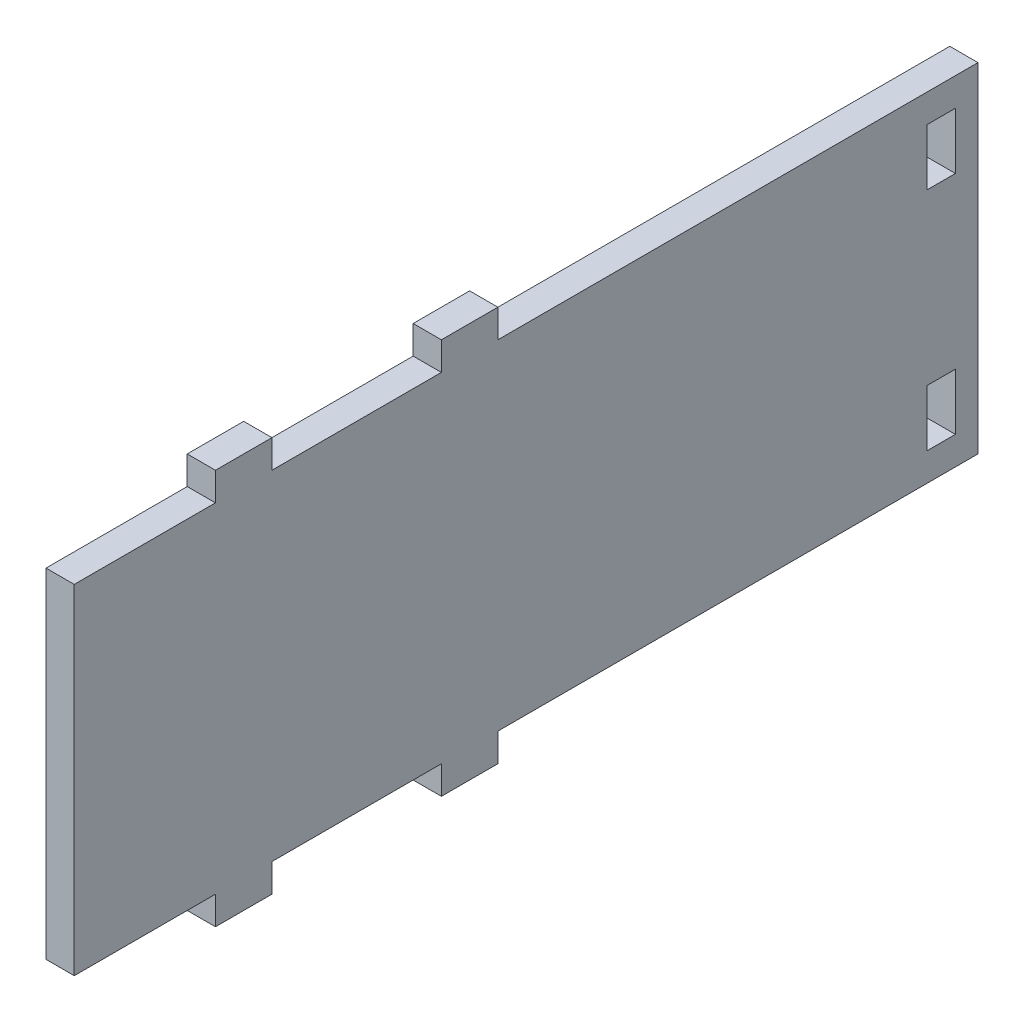
from build123d import *

# Parameters (mm, degrees)
SKETCH1_3_W         = 2.5
SKETCH1_3_H         = 5
BOSS_EXTRUDE2_DEPTH = 2.5


with BuildPart() as part:
    # Sketch1<3> → Boss-Extrude2 (new body)
    with BuildSketch(Plane(origin=(0, 0, 0), x_dir=(0, 0, -1), z_dir=(1, 0, 0))):
        Polygon((-57.5, 17.5), (-57.5, 15), (-72.5, 15), (-72.5, 17.5), (-77.5, 17.5), (-77.5, 15), (-90, 15), (-90, -15), (-77.5, -15), (-77.5, -17.5), (-72.5, -17.5), (-72.5, -15), (-57.5, -15), (-57.5, -17.5), (-52.5, -17.5), (-52.5, -15), (-10, -15), (-10, 15), (-52.5, 15), (-52.5, 17.5), align=None)
        with Locations((-13.25, 10)):
            Rectangle(SKETCH1_3_W, SKETCH1_3_H, mode=Mode.SUBTRACT)
        with Locations((-13.25, -10)):
            Rectangle(SKETCH1_3_W, SKETCH1_3_H, mode=Mode.SUBTRACT)
    extrude(amount=BOSS_EXTRUDE2_DEPTH)


solid = part.part
